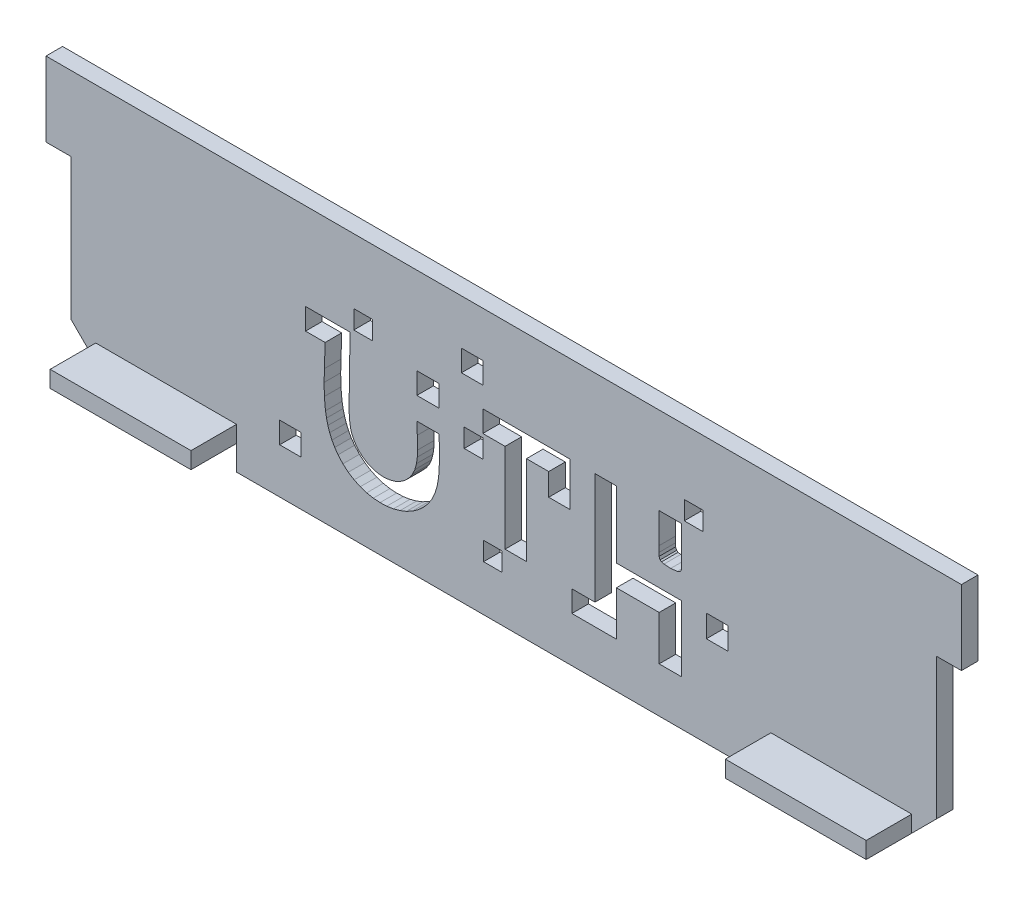
from build123d import *

# Parameters (mm, degrees)
BOSS_EXTRUDE1_DEPTH = 2
SKETCH2_W           = 17
SKETCH2_H           = 2
BOSS_EXTRUDE2_DEPTH = 5.5
SKETCH3_W           = 2.580637968
SKETCH3_H           = 2.580641016
SKETCH3_W_2         = 2.241280605
SKETCH3_H_2         = 2.241280605
SKETCH3_W_3         = 2.688165312
SKETCH3_H_3         = 2.580637968
SKETCH3_W_4         = 2.580640102
SKETCH3_H_4         = 2.68816836
SKETCH3_W_5         = 2.580641016
CUT_EXTRUDE1_DEPTH  = 5


with BuildPart() as part:
    # Sketch1 → Boss-Extrude1 (new body)
    with BuildSketch(Plane.XY):
        Polygon((-32.25, 0), (32.25, 0), (32.25, 3), (49.25, 3), (52.25, 6), (52.25, 23), (55.25, 23), (55.25, 32), (-55.25, 32), (-55.25, 23), (-52.25, 23), (-52.25, 6), (-49.25, 3), (-32.25, 3), align=None)
    extrude(amount=BOSS_EXTRUDE1_DEPTH)

    # Sketch2 → Boss-Extrude2 (add)
    with BuildSketch(Plane.XY.offset(2)):
        with Locations((-40.75, 4)):
            Rectangle(SKETCH2_W, SKETCH2_H)
        with Locations((40.75, 4)):
            Rectangle(SKETCH2_W, SKETCH2_H)
    extrude(amount=BOSS_EXTRUDE2_DEPTH)

    # Sketch3 → Cut-Extrude1 (cut)
    with BuildSketch(Plane(origin=(0, 0, 0), x_dir=(-1, 0, 0), z_dir=(0, 0, -1))):
        with Locations((3.81719709, 25.247293672)):
            Rectangle(SKETCH3_W, SKETCH3_H)
        with Locations((-22.915804717, 23.05138755)):
            Rectangle(SKETCH3_W_2, SKETCH3_H_2)
        Polygon((-21.451570254, 21.483859492), (-21.451570254, 17.935481524), (-21.490182318, 17.186866511), (-21.476760755, 16.797579304), (-21.386689002, 16.464291172), (-21.231630232, 16.327958094), (-20.947078705, 16.228780137), (-20.157604338, 16.139996469), (-19.354479198, 16.194152418), (-19.052864358, 16.273649135), (-18.873917192, 16.387460236), (-18.751023052, 16.692507734), (-18.724770323, 17.0838688), (-18.763403723, 17.82795418), (-18.763403723, 21.483859492), align=None)
        with Locations((16.980823721, 23.05138755)):
            Rectangle(SKETCH3_W_2, SKETCH3_H_2)
        Polygon((-13.60212352, 21.483859492), (-13.60212352, 13.419360508), (-21.451570254, 13.419360508), (-21.451570254, 5.46238582), (-18.763403723, 5.46238582), (-18.763403723, 10.838719492), (-13.60212352, 10.838719492), (-13.60212352, 5.46238582), (-8.225790152, 5.46238582), (-8.225790152, 8.043026836), (-11.021483418, 8.043026836), (-11.021483418, 21.483859492), align=None)
        Polygon((-8.010736988, 21.483859492), (-8.010736988, 16.215053164), (-5.430096887, 16.215053164), (-5.430096887, 18.903221524), (-2.741930356, 18.903221524), (-2.741930356, 8.15055418), (-0.161290254, 8.15055418), (-0.161290254, 18.903221524), (2.526878106, 18.903221524), (2.526878106, 21.483859492), align=None)
        with Locations((3.647518408, 17.335693467)):
            Rectangle(SKETCH3_W_2, SKETCH3_H_2)
        with Locations((9.13976709, 20.193540508)):
            Rectangle(SKETCH3_W_3, SKETCH3_H_3)
        Polygon((18.54834873, 21.483859492), (18.602112402, 17.936682436), (18.655876074, 14.387100508), (18.662800216, 13.409194818), (18.630388393, 12.40793962), (18.478863779, 11.42852517), (18.333504049, 10.96112961), (18.128450154, 10.516140508), (17.811648959, 10.023003064), (17.444951089, 9.593525234), (17.035386148, 9.227963049), (16.589983736, 8.926572846), (16.115772848, 8.689610963), (15.619783696, 8.517333736), (15.109044966, 8.409997806), (14.590586567, 8.367859206), (14.071437796, 8.391173968), (13.558628255, 8.480199038), (13.059187242, 8.635190142), (12.58014436, 8.856404229), (12.1285286, 9.144097024), (11.711370176, 9.498525474), (11.33569808, 9.919945307), (11.00854161, 10.408613164), (10.716068027, 11.052540045), (10.529929105, 11.749061994), (10.429370099, 12.483578178), (10.393636261, 13.241488372), (10.433622973, 14.76908745), (10.483849746, 16.215053164), (7.795684434, 16.215053164), (7.763966032, 14.373321414), (7.786948866, 12.471897633), (7.874330149, 11.531087627), (8.04183939, 10.614098351), (8.311627319, 9.733844181), (8.705844666, 8.903239492), (9.182301016, 8.190905738), (9.735606894, 7.557466415), (10.355845938, 7.004639682), (11.033102089, 6.534144306), (11.757459289, 6.14769814), (12.51900148, 5.84701995), (13.307812602, 5.633827895), (14.113976293, 5.509840132), (14.927576495, 5.476775123), (15.738697453, 5.536351331), (16.5374225, 5.690287218), (17.313836188, 5.940300638), (18.058021847, 6.288110356), (18.76006342, 6.735434531), (19.410045152, 7.283991321), (19.998050682, 7.935499492), (20.398488388, 8.506577954), (20.732234939, 9.110218504), (21.004927916, 9.742712337), (21.222204596, 10.400350341), (21.38970256, 11.07942371), (21.513059082, 11.776223637), (21.649898432, 13.208167331), (21.67782177, 14.666510058), (21.641929436, 16.121580758), (21.559096074, 18.903221524), (23.924682402, 18.903221524), (23.924682402, 21.483859492), align=None)
        with Locations((-25.752637039, 12.278477871)):
            Rectangle(SKETCH3_W_4, SKETCH3_H_4)
        Polygon((0.192376871, 7.784525328), (0.192274032, 5.543244726), (2.433554635, 5.543347565), (2.433657474, 7.784628168), align=None)
        with Locations((25.752636582, 6.752706328)):
            Rectangle(SKETCH3_W_5, SKETCH3_H)
    extrude(amount=-CUT_EXTRUDE1_DEPTH, mode=Mode.SUBTRACT)


solid = part.part
